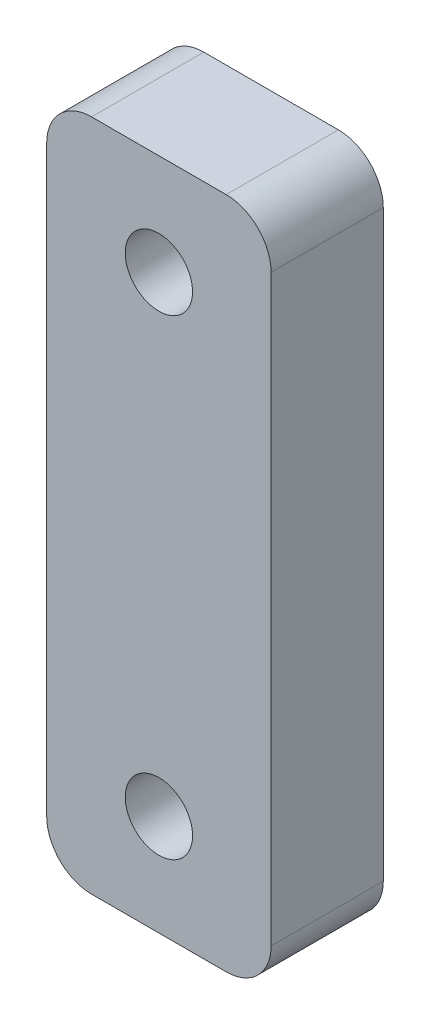
from build123d import *

# Parameters (mm, degrees)
SKETCH_2_W          = 10
SKETCH_2_H          = 30
EXTRUDE_1_DEPTH     = 5
SKETCH_3_R          = 1.5
CUT_EXTRUDE_1_DEPTH = 17.583123952
FILLET_1_R          = 2


with BuildPart() as part:
    # 草图2 → 凸台-拉伸1 (new body)
    with BuildSketch(Plane.XY):
        Rectangle(SKETCH_2_W, SKETCH_2_H)
    extrude(amount=EXTRUDE_1_DEPTH)

    # 草图3 → 切除-拉伸1 (cut, through all)
    with BuildSketch(Plane.XY.offset(5)):
        with Locations((0, -10.5)):
            Circle(SKETCH_3_R)
        with Locations(Location((0, 10.5, 0), (0, 0, 180))):
            Circle(SKETCH_3_R)
    extrude(amount=-CUT_EXTRUDE_1_DEPTH, mode=Mode.SUBTRACT)

    # 圆角1
    fillet_1_edges = [part.edges().sort_by_distance(p)[0] for p in [
        (-5, 15, 2.5),
        (5, 15, 2.5),
        (5, -15, 2.5),
        (-5, -15, 2.5),
    ]]
    fillet(fillet_1_edges, radius=FILLET_1_R)


solid = part.part
